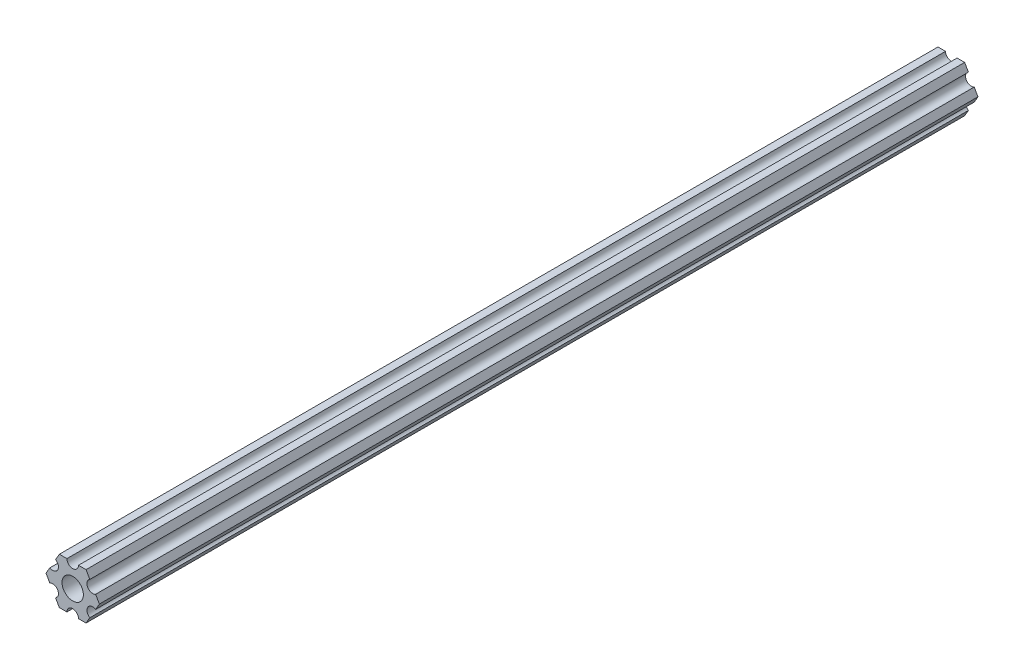
from build123d import *

# Parameters (mm, degrees)
SKETCH1_R           = 2.9337
BOSS_EXTRUDE1_DEPTH = 241.3


with BuildPart() as part:
    # Sketch1 → Boss-Extrude1 (new body)
    with BuildSketch(Plane.XY):
        with BuildLine():
            Line((-4.70551159, -4.549815043), (-3.666174521, -6.349999904))
            Line((-3.666174521, -6.349999904), (-1.587501154, -6.349999904))
            ThreePointArc((-1.587501154, -6.349999904), (-3.85e-07, -4.762499134), (1.587501154, -6.349999904))
            Line((1.587501154, -6.349999904), (3.666173825, -6.349999904))
            Line((3.666173825, -6.349999904), (4.705510929, -4.549815232))
            ThreePointArc((4.705510929, -4.549815232), (4.124445601, -2.381249904), (6.293010929, -1.800184575))
            Line((6.293010929, -1.800184575), (7.332348034, 9.6e-08))
            Line((7.332348034, 9.6e-08), (6.293011178, 1.800184715))
            ThreePointArc((6.293011178, 1.800184715), (4.124445902, 2.381250241), (4.705511428, 4.549815516))
            Line((4.705511428, 4.549815516), (3.666174521, 6.350000222))
            Line((3.666174521, 6.350000222), (1.587498846, 6.350000222))
            ThreePointArc((1.587498846, 6.350000222), (3.85e-07, 4.762501761), (-1.587498846, 6.350000222))
            Line((-1.587498846, 6.350000222), (-3.666173825, 6.350000222))
            Line((-3.666173825, 6.350000222), (-4.705511038, 4.549815614))
            ThreePointArc((-4.705511038, 4.549815614), (-4.124445841, 2.38125025), (-6.293011205, 1.800185053))
            Line((-6.293011205, 1.800185053), (-7.332348419, 4.44e-07))
            Line((-7.332348419, 4.44e-07), (-6.293011423, -1.80018429))
            ThreePointArc((-6.293011423, -1.80018429), (-4.12444613, -2.38124975), (-4.70551159, -4.549815043))
        make_face()
        Circle(SKETCH1_R, mode=Mode.SUBTRACT)
    extrude(amount=-BOSS_EXTRUDE1_DEPTH)


solid = part.part
